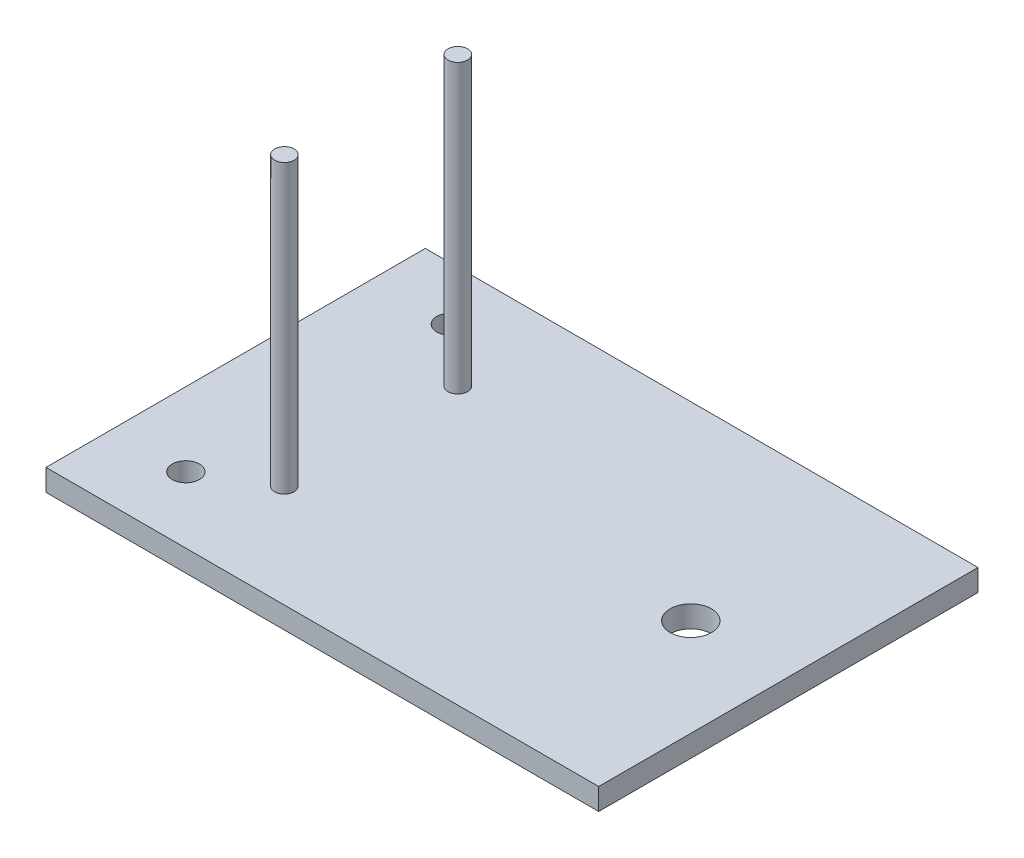
from build123d import *

# Parameters (mm, degrees)
SKETCH1_W           = 510
SKETCH1_H           = 350
SKETCH1_R           = 19.05
SKETCH1_R_2         = 12.5
BOSS_EXTRUDE1_DEPTH = 20
SKETCH3_R           = 9
BOSS_EXTRUDE2_DEPTH = 265


with BuildPart() as part:
    # Sketch1 → Boss-Extrude1 (new body)
    with BuildSketch(Plane(origin=(0, 0, 0), x_dir=(1, 0, 0), z_dir=(0, 1, 0))):
        with Locations((-165, 0)):
            Rectangle(SKETCH1_W, SKETCH1_H)
        with Locations(Location((0, 0, 0), (0, 0, 270))):
            Circle(SKETCH1_R, mode=Mode.SUBTRACT)
        with Locations(Location((-347.89, 125.98, 0), (0, 0, 270))):
            Circle(SKETCH1_R_2, mode=Mode.SUBTRACT)
        with Locations(Location((-352, -113.99, 0), (0, 0, 270))):
            Circle(SKETCH1_R_2, mode=Mode.SUBTRACT)
    extrude(amount=BOSS_EXTRUDE1_DEPTH)

    # Sketch3 → Boss-Extrude2 (add)
    with BuildSketch(Plane(origin=(0, 20, 0), x_dir=(1, 0, 0), z_dir=(0, 1, 0))):
        with Locations(Location((-295, 80, 0), (0, 0, 270))):
            Circle(SKETCH3_R)
        with Locations(Location((-295, -80, 0), (0, 0, 270))):
            Circle(SKETCH3_R)
    extrude(amount=BOSS_EXTRUDE2_DEPTH)


solid = part.part
